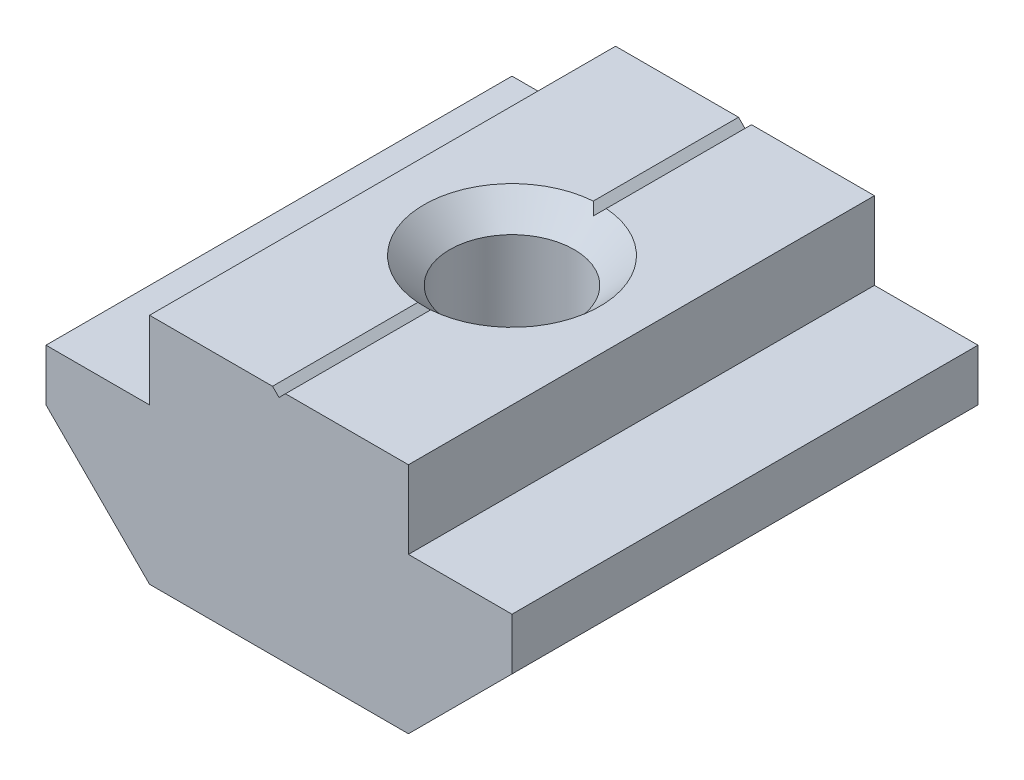
from build123d import *

# Parameters (mm, degrees)
EXTRUDED_1_DEPTH = 18


with BuildPart() as part:
    # Эскиз1 → Extruded 1 (new body)
    with BuildSketch(Plane.XY):
        Polygon((-5, 0), (-9, 4), (-9, 6), (-5, 6), (-5, 9), (-0.25, 9), (0, 8.75), (0.25, 9), (5, 9), (5, 6), (9, 6), (9, 4), (5, 0), align=None)
    extrude(amount=EXTRUDED_1_DEPTH)

    # Эскиз2 → Revolved Cut 1 (revolve, cut)
    with BuildSketch(Plane(origin=(0, 0, 0), x_dir=(0, 0, -1), z_dir=(1, 0, 0))):
        Polygon((-9, 0), (-9, 9), (-5.6, 9), (-6.6, 8), (-6.6, 1), (-5.6, 0), align=None)
    revolve(axis=Axis((0, 0, 9), (0, 1, 0)), mode=Mode.SUBTRACT)


solid = part.part
